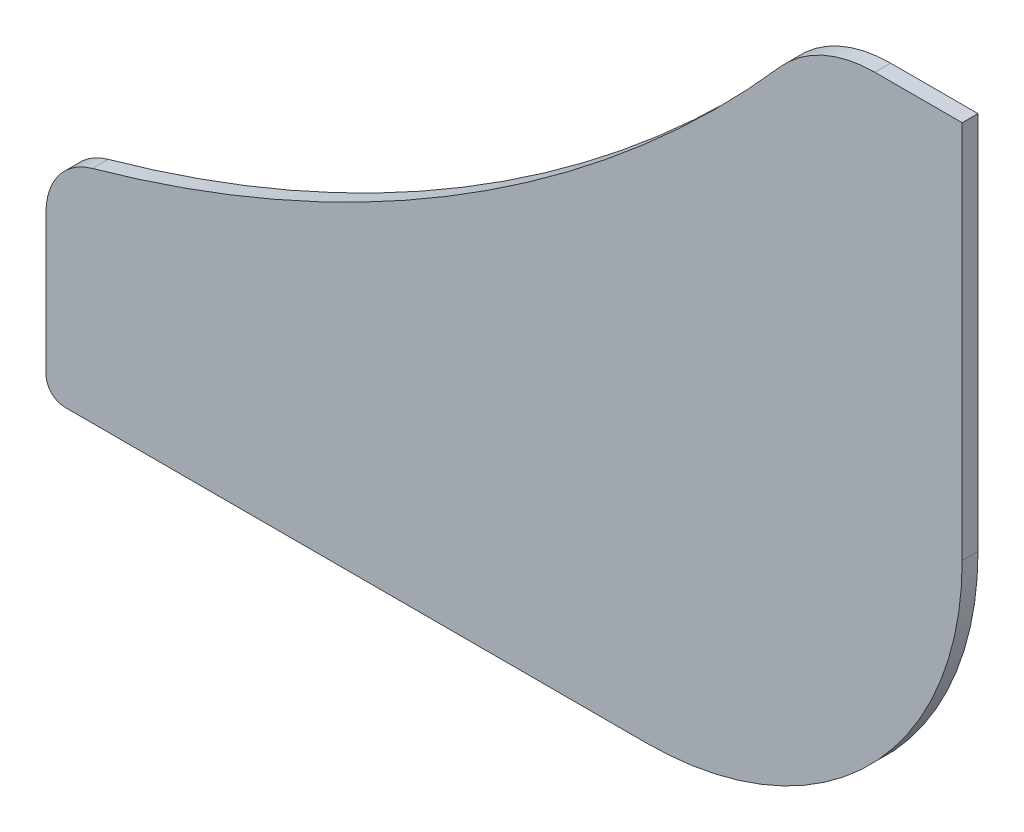
from build123d import *

# Parameters (mm, degrees)
BOSS_EXTRUDE1_DEPTH = 6.35
FILLET1_R           = 25.4


with BuildPart() as part:
    # Sketch1 → Boss-Extrude1 (new body)
    with BuildSketch(Plane.XY):
        with BuildLine():
            Line((203.2, -203.2), (203.2, -279.4))
            ThreePointArc((203.2, -279.4), (205.431846327, -284.788153673), (210.82, -287.02))
            Line((210.82, -287.02), (444.471225938, -287.02))
            ThreePointArc((444.471225938, -287.02), (534.273787149, -249.822561211), (571.471225938, -160.02))
            Line((571.471225938, -160.02), (571.471225938, -7.62))
            Line((571.471225938, -7.62), (536.346383071, -7.62))
            ThreePointArc((536.346383071, -7.62), (515.412320101, -12.133878888), (498.198486458, -24.873346158))
            ThreePointArc((498.198486458, -24.873346158), (364.438041528, -136.764204924), (203.2, -203.2))
        make_face()
    extrude(amount=BOSS_EXTRUDE1_DEPTH)

    # Fillet1
    fillet1_edges = [part.edges().sort_by_distance(p)[0] for p in [
        (203.2, -203.2, 3.175),
    ]]
    fillet(fillet1_edges, radius=FILLET1_R)


solid = part.part
